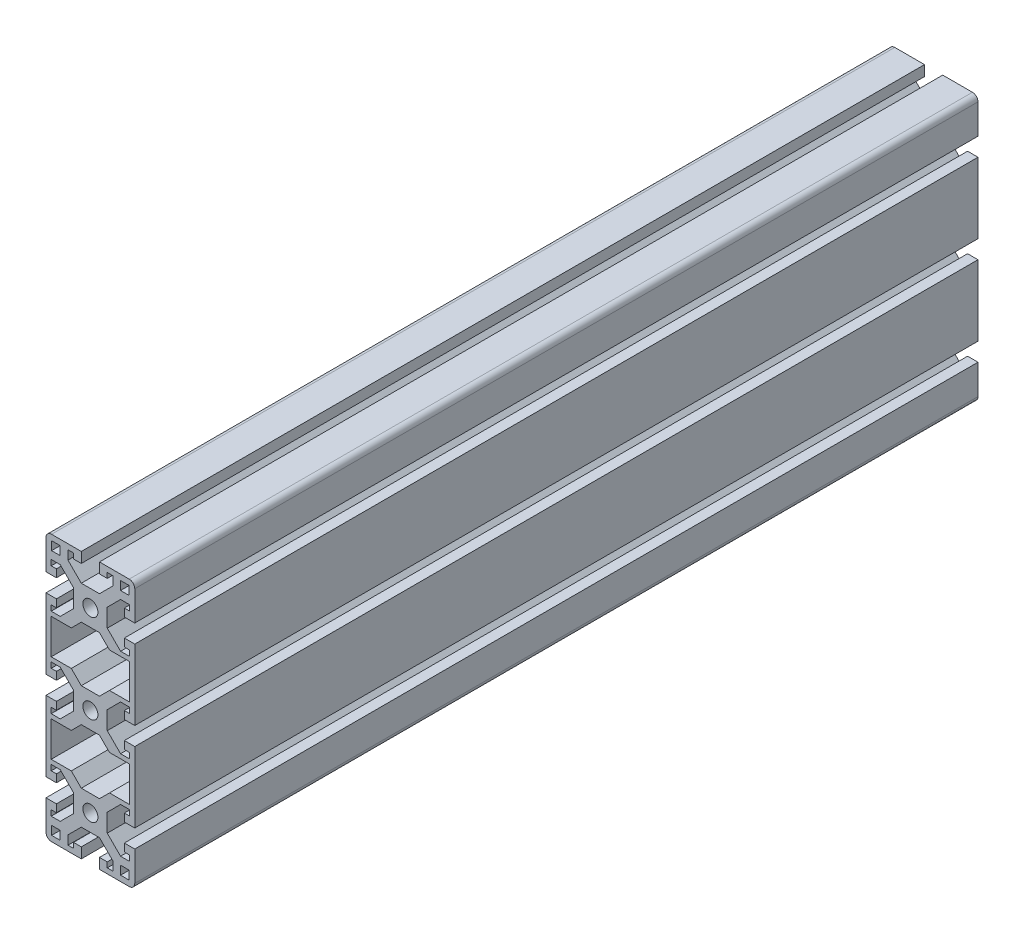
from build123d import *

# Parameters (mm, degrees)
SKETCH2_W                      = 3.9
SKETCH2_H                      = 3.9
F_40_SERIES_TS40_120LM_1_DEPTH = 380
M8X1_25_TAPPED_HOLE1_D         = 6.8
M8X1_25_TAPPED_HOLE1_DEPTH     = 30
M8X1_25_TAPPED_HOLE1_TIP       = 2.042926105
M8X1_25_TAPPED_HOLE2_D         = 6.8
M8X1_25_TAPPED_HOLE2_DEPTH     = 30
M8X1_25_TAPPED_HOLE2_TIP       = 2.042926105


with BuildPart() as part:
    # Sketch2 → 40 series TS40-120LM(1) (new body)
    with BuildSketch(Plane.XY.offset(-190)):
        with BuildLine():
            Line((15.3, -35.9), (20, -35.9))
            Line((20, -35.9), (20, -4.1))
            Line((20, -4.1), (15.3, -4.1))
            Line((15.3, -4.1), (15.3, -7.6))
            Line((15.3, -7.6), (17.65, -7.6))
            Line((17.65, -7.6), (17.65, -10.1))
            Line((17.65, -10.1), (13.6, -10.1))
            Line((13.6, -10.1), (7.6, -4.1))
            Line((7.6, -4.1), (7.6, 4.1))
            Line((7.6, 4.1), (13.6, 10.1))
            Line((13.6, 10.1), (17.65, 10.1))
            Line((17.65, 10.1), (17.65, 7.6))
            Line((17.65, 7.6), (15.3, 7.6))
            Line((15.3, 7.6), (15.3, 4.1))
            Line((15.3, 4.1), (20, 4.1))
            Line((20, 4.1), (20, 35.9))
            Line((20, 35.9), (15.3, 35.9))
            Line((15.3, 35.9), (15.3, 32.4))
            Line((15.3, 32.4), (17.65, 32.4))
            Line((17.65, 32.4), (17.65, 29.9))
            Line((17.65, 29.9), (13.6, 29.9))
            Line((13.6, 29.9), (7.6, 35.9))
            Line((7.6, 35.9), (7.6, 44.1))
            Line((7.6, 44.1), (13.6, 50.1))
            Line((13.6, 50.1), (17.65, 50.1))
            Line((17.65, 50.1), (17.65, 47.6))
            Line((17.65, 47.6), (15.3, 47.6))
            Line((15.3, 47.6), (15.3, 44.1))
            Line((15.3, 44.1), (20, 44.1))
            Line((20, 44.1), (20, 57.5))
            ThreePointArc((20, 57.5), (19.267766953, 59.267766953), (17.5, 60))
            Line((17.5, 60), (4.1, 60))
            Line((4.1, 60), (4.1, 55.3))
            Line((4.1, 55.3), (7.6, 55.3))
            Line((7.6, 55.3), (7.6, 57.65))
            Line((7.6, 57.65), (10.1, 57.65))
            Line((10.1, 57.65), (10.1, 53.6))
            Line((10.1, 53.6), (4.1, 47.6))
            Line((4.1, 47.6), (-4.1, 47.6))
            Line((-4.1, 47.6), (-10.1, 53.6))
            Line((-10.1, 53.6), (-10.1, 57.65))
            Line((-10.1, 57.65), (-7.6, 57.65))
            Line((-7.6, 57.65), (-7.6, 55.3))
            Line((-7.6, 55.3), (-4.1, 55.3))
            Line((-4.1, 55.3), (-4.1, 60))
            Line((-4.1, 60), (-17.5, 60))
            ThreePointArc((-17.5, 60), (-19.267766953, 59.267766953), (-20, 57.5))
            Line((-20, 57.5), (-20, 44.1))
            Line((-20, 44.1), (-15.3, 44.1))
            Line((-15.3, 44.1), (-15.3, 47.6))
            Line((-15.3, 47.6), (-17.65, 47.6))
            Line((-17.65, 47.6), (-17.65, 50.1))
            Line((-17.65, 50.1), (-13.6, 50.1))
            Line((-13.6, 50.1), (-7.6, 44.1))
            Line((-7.6, 44.1), (-7.6, 35.9))
            Line((-7.6, 35.9), (-13.6, 29.9))
            Line((-13.6, 29.9), (-17.65, 29.9))
            Line((-17.65, 29.9), (-17.65, 32.4))
            Line((-17.65, 32.4), (-15.3, 32.4))
            Line((-15.3, 32.4), (-15.3, 35.9))
            Line((-15.3, 35.9), (-20, 35.9))
            Line((-20, 35.9), (-20, 4.1))
            Line((-20, 4.1), (-15.3, 4.1))
            Line((-15.3, 4.1), (-15.3, 7.6))
            Line((-15.3, 7.6), (-17.65, 7.6))
            Line((-17.65, 7.6), (-17.65, 10.1))
            Line((-17.65, 10.1), (-13.6, 10.1))
            Line((-13.6, 10.1), (-7.6, 4.1))
            Line((-7.6, 4.1), (-7.6, -4.1))
            Line((-7.6, -4.1), (-13.6, -10.1))
            Line((-13.6, -10.1), (-17.65, -10.1))
            Line((-17.65, -10.1), (-17.65, -7.6))
            Line((-17.65, -7.6), (-15.3, -7.6))
            Line((-15.3, -7.6), (-15.3, -4.1))
            Line((-15.3, -4.1), (-20, -4.1))
            Line((-20, -4.1), (-20, -35.9))
            Line((-20, -35.9), (-15.3, -35.9))
            Line((-15.3, -35.9), (-15.3, -32.4))
            Line((-15.3, -32.4), (-17.65, -32.4))
            Line((-17.65, -32.4), (-17.65, -29.9))
            Line((-17.65, -29.9), (-13.6, -29.9))
            Line((-13.6, -29.9), (-7.6, -35.9))
            Line((-7.6, -35.9), (-7.6, -44.1))
            Line((-7.6, -44.1), (-13.6, -50.1))
            Line((-13.6, -50.1), (-17.65, -50.1))
            Line((-17.65, -50.1), (-17.65, -47.6))
            Line((-17.65, -47.6), (-15.3, -47.6))
            Line((-15.3, -47.6), (-15.3, -44.1))
            Line((-15.3, -44.1), (-20, -44.1))
            Line((-20, -44.1), (-20, -57.5))
            ThreePointArc((-20, -57.5), (-19.267766953, -59.267766953), (-17.5, -60))
            Line((-17.5, -60), (-4.1, -60))
            Line((-4.1, -60), (-4.1, -55.3))
            Line((-4.1, -55.3), (-7.6, -55.3))
            Line((-7.6, -55.3), (-7.6, -57.65))
            Line((-7.6, -57.65), (-10.1, -57.65))
            Line((-10.1, -57.65), (-10.1, -53.6))
            Line((-10.1, -53.6), (-4.1, -47.6))
            Line((-4.1, -47.6), (4.1, -47.6))
            Line((4.1, -47.6), (10.1, -53.6))
            Line((10.1, -53.6), (10.1, -57.65))
            Line((10.1, -57.65), (7.6, -57.65))
            Line((7.6, -57.65), (7.6, -55.3))
            Line((7.6, -55.3), (4.1, -55.3))
            Line((4.1, -55.3), (4.1, -60))
            Line((4.1, -60), (17.5, -60))
            ThreePointArc((17.5, -60), (19.267766953, -59.267766953), (20, -57.5))
            Line((20, -57.5), (20, -44.1))
            Line((20, -44.1), (15.3, -44.1))
            Line((15.3, -44.1), (15.3, -47.6))
            Line((15.3, -47.6), (17.65, -47.6))
            Line((17.65, -47.6), (17.65, -50.1))
            Line((17.65, -50.1), (13.6, -50.1))
            Line((13.6, -50.1), (7.6, -44.1))
            Line((7.6, -44.1), (7.6, -35.9))
            Line((7.6, -35.9), (13.6, -29.9))
            Line((13.6, -29.9), (17.65, -29.9))
            Line((17.65, -29.9), (17.65, -32.4))
            Line((17.65, -32.4), (15.3, -32.4))
            Line((15.3, -32.4), (15.3, -35.9))
        make_face()
        Polygon((-4.1, -7.6), (4.1, -7.6), (8.6, -12.1), (17.65, -12.1), (17.65, -27.9), (8.6, -27.9), (4.1, -32.4), (-4.1, -32.4), (-8.6, -27.9), (-17.65, -27.9), (-17.65, -12.1), (-8.6, -12.1), align=None, mode=Mode.SUBTRACT)
        Polygon((-4.1, 7.6), (-8.6, 12.1), (-17.65, 12.1), (-17.65, 27.9), (-8.6, 27.9), (-4.1, 32.4), (4.1, 32.4), (8.6, 27.9), (17.65, 27.9), (17.65, 12.1), (8.6, 12.1), (4.1, 7.6), align=None, mode=Mode.SUBTRACT)
        with Locations((15.55, -55.55)):
            Rectangle(SKETCH2_W, SKETCH2_H, mode=Mode.SUBTRACT)
        with Locations((-15.55, -55.55)):
            Rectangle(SKETCH2_W, SKETCH2_H, mode=Mode.SUBTRACT)
        with Locations((-15.55, 55.55)):
            Rectangle(SKETCH2_W, SKETCH2_H, mode=Mode.SUBTRACT)
        with Locations((15.55, 55.55)):
            Rectangle(SKETCH2_W, SKETCH2_H, mode=Mode.SUBTRACT)
        with BuildLine():
            ThreePointArc((0, -43.35), (3.35, -40), (0, -36.65))
            ThreePointArc((0, -36.65), (-3.35, -40), (0, -43.35))
        make_face(mode=Mode.SUBTRACT)
        with BuildLine():
            ThreePointArc((3.35, 0), (0, -3.35), (-3.35, 0))
            ThreePointArc((-3.35, 0), (0, 3.35), (3.35, 0))
        make_face(mode=Mode.SUBTRACT)
        with BuildLine():
            ThreePointArc((0, 43.35), (-3.35, 40), (0, 36.65))
            ThreePointArc((0, 36.65), (3.35, 40), (0, 43.35))
        make_face(mode=Mode.SUBTRACT)
    extrude(amount=F_40_SERIES_TS40_120LM_1_DEPTH)

    # M8x1.25 Tapped Hole1
    with Locations(Plane.XY.offset(190)):
        with Locations((0, 40), (0, 0), (0, -40)):
            Hole(M8X1_25_TAPPED_HOLE1_D / 2, depth=M8X1_25_TAPPED_HOLE1_DEPTH)
            with Locations((0, 0, -(M8X1_25_TAPPED_HOLE1_DEPTH + M8X1_25_TAPPED_HOLE1_TIP / 2))):  # 118° drill point
                Cone(0, M8X1_25_TAPPED_HOLE1_D / 2, M8X1_25_TAPPED_HOLE1_TIP, mode=Mode.SUBTRACT)

    # M8x1.25 Tapped Hole2
    with Locations(Plane(origin=(0, 0, -190), x_dir=(-1, 0, 0), z_dir=(0, 0, -1))):
        with Locations((0, 40), (0, 0)):
            Hole(M8X1_25_TAPPED_HOLE2_D / 2, depth=M8X1_25_TAPPED_HOLE2_DEPTH)
            with Locations((0, 0, -(M8X1_25_TAPPED_HOLE2_DEPTH + M8X1_25_TAPPED_HOLE2_TIP / 2))):  # 118° drill point
                Cone(0, M8X1_25_TAPPED_HOLE2_D / 2, M8X1_25_TAPPED_HOLE2_TIP, mode=Mode.SUBTRACT)


solid = part.part
